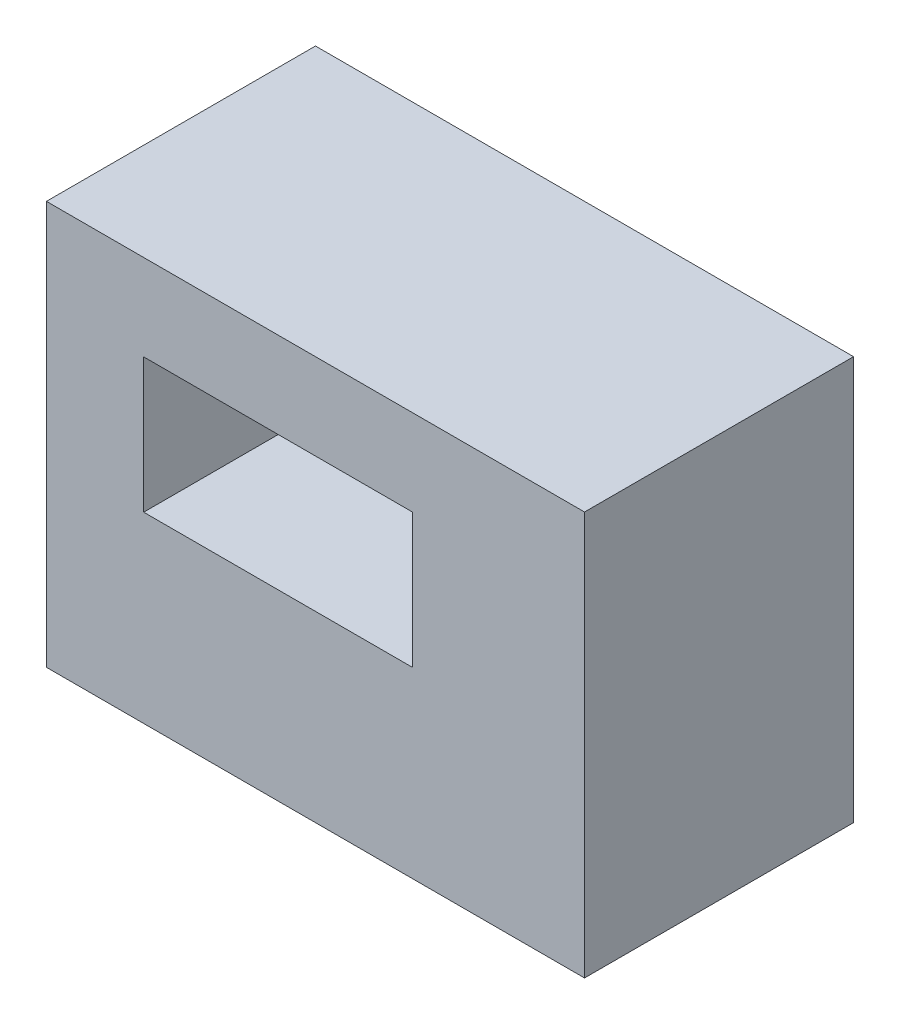
from build123d import *

# Parameters (mm, degrees)
SKETCH1_W           = 101.6
SKETCH1_H           = 76.2
BOSS_EXTRUDE1_DEPTH = 50.8
SKETCH2_W           = 50.8
SKETCH2_H           = 25.4
CUT_EXTRUDE1_DEPTH  = 25.4


with BuildPart() as part:
    # Sketch1 → Boss-Extrude1 (new body)
    with BuildSketch(Plane.XY):
        with Locations((-17.769547325, 1.829218107)):
            Rectangle(SKETCH1_W, SKETCH1_H)
    extrude(amount=BOSS_EXTRUDE1_DEPTH)

    # Sketch2 → Cut-Extrude1 (cut)
    with BuildSketch(Plane.XY.offset(50.8)):
        with Locations((-24.806057598, 10.979921456)):
            Rectangle(SKETCH2_W, SKETCH2_H)
    extrude(amount=-CUT_EXTRUDE1_DEPTH, mode=Mode.SUBTRACT)


solid = part.part
